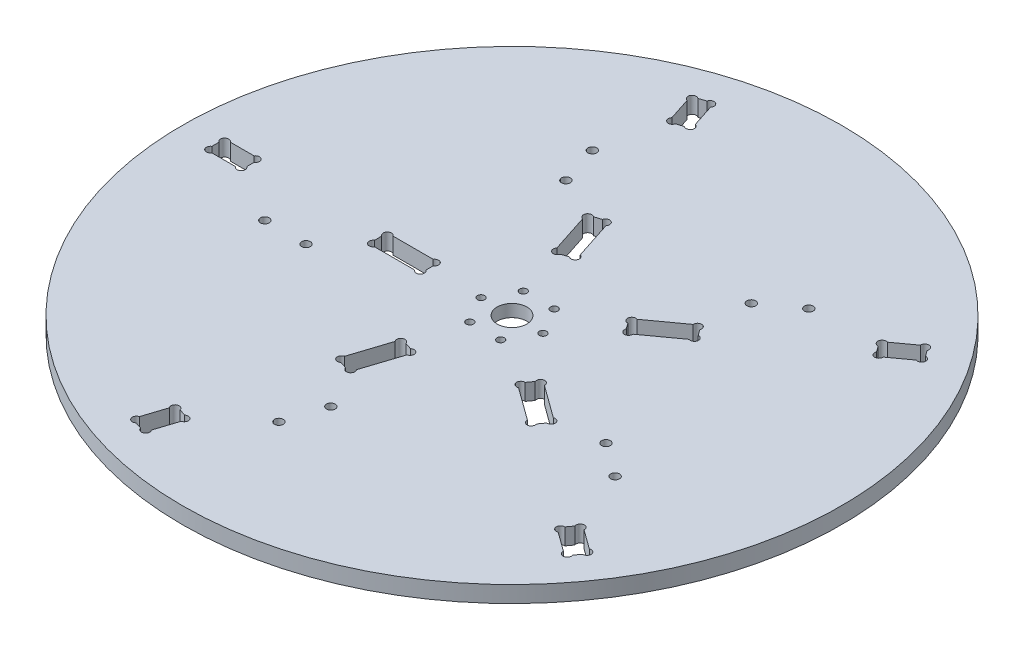
from build123d import *

# Parameters (mm, degrees)
SKETCH1_R                                = 254
BOSS_EXTRUDE1_DEPTH                      = 6.35
F_10_CLEARANCE_HOLE1_D                   = 5.6134
SKETCH3_W                                = 39.6875
SKETCH3_H                                = 14.2875
SKETCH3_W_2                              = 26.9875
CUT_EXTRUDE2_DEPTH                       = 360.434681131
F_1_4_CLEARANCE_HOLE1_D                  = 6.7564
F_1_4_0_2500_DOWEL_HOLE2_D               = 6.35
CIRPATTERN1_COUNT                        = 5
CBORE_FOR_1_4_HEX_HEAD_BOLT1_D           = 22.86
CBORE_FOR_1_4_HEX_HEAD_BOLT1_CBORE_D     = 31.75
CBORE_FOR_1_4_HEX_HEAD_BOLT1_CBORE_DEPTH = 3.175


with BuildPart() as part:
    # Sketch1 → Boss-Extrude1 (new, symmetric)
    with BuildSketch(Plane(origin=(0, 0, 0), x_dir=(1, 0, 0), z_dir=(0, 1, 0))):
        with Locations(Location((0, 0, 0), (0, 0, 270))):
            Circle(SKETCH1_R)
    extrude(amount=BOSS_EXTRUDE1_DEPTH, both=True)

    # #10 Clearance Hole1 (through all)
    with Locations(Plane(origin=(0, 6.35, 0), x_dir=(1, 0, 0), z_dir=(0, 1, 0))):
        with Locations((-11.90625, 20.622229928), (11.90625, 20.622229928), (23.8125, 0), (11.90625, -20.622229928), (-11.90625, -20.622229928), (-23.8125, 0)):
            Hole(F_10_CLEARANCE_HOLE1_D / 2)

    # Sketch3 → Cut-Extrude2 (cut, through all)
    with BuildSketch(Plane(origin=(0, 6.35, 0), x_dir=(1, 0, 0), z_dir=(0, 1, 0))):
        with Locations((-83.34375, 0)):
            Rectangle(SKETCH3_W, SKETCH3_H)
        with Locations((-215.10625, 0)):
            Rectangle(SKETCH3_W_2, SKETCH3_H)
    cut_extrude2 = extrude(amount=-CUT_EXTRUDE2_DEPTH, mode=Mode.SUBTRACT)

    # 1/4 Clearance Hole1 (through all)
    with Locations(Plane(origin=(0, 6.35, 0), x_dir=(1, 0, 0), z_dir=(0, 1, 0))):
        with Locations((-158.75, -31.75), (-127, -31.75)):
            f_1_4_clearance_hole1 = Hole(F_1_4_CLEARANCE_HOLE1_D / 2)

    # 1/4 (0.2500) Dowel Hole2 (through all)
    with Locations(Plane(origin=(0, 6.35, 0), x_dir=(1, 0, 0), z_dir=(0, 1, 0))):
        with Locations((-65.183798023, 5.459951977), (-65.183798023, -5.459951977), (-101.503701977, -5.459951977), (-101.503701977, 5.459951977), (-203.296298023, 5.459951977), (-203.296298023, -5.459951977), (-226.916201977, -5.459951977), (-226.916201977, 5.459951977)):
            f_1_4_0_2500_dowel_hole2 = Hole(F_1_4_0_2500_DOWEL_HOLE2_D / 2)

    # CirPattern1: Cut-Extrude2, 1/4 Clearance Hole1, 1/4 (0.2500) Dowel Hole2 ×5 about axis
    cirpattern1_axis = Axis((0, 0, 0), (0, 1, 0))
    add([cut_extrude2.rotate(cirpattern1_axis, i * 360 / CIRPATTERN1_COUNT) for i in range(1, CIRPATTERN1_COUNT)], mode=Mode.SUBTRACT)
    add([f_1_4_clearance_hole1.rotate(cirpattern1_axis, i * 360 / CIRPATTERN1_COUNT) for i in range(1, CIRPATTERN1_COUNT)], mode=Mode.SUBTRACT)
    add([f_1_4_0_2500_dowel_hole2.rotate(cirpattern1_axis, i * 360 / CIRPATTERN1_COUNT) for i in range(1, CIRPATTERN1_COUNT)], mode=Mode.SUBTRACT)

    # CBORE for 1/4 Hex Head Bolt1 (through all)
    with Locations(Plane.XZ.offset(6.35)):
        with Locations((0, 0)):
            CounterBoreHole(CBORE_FOR_1_4_HEX_HEAD_BOLT1_D / 2, CBORE_FOR_1_4_HEX_HEAD_BOLT1_CBORE_D / 2, CBORE_FOR_1_4_HEX_HEAD_BOLT1_CBORE_DEPTH)


solid = part.part
